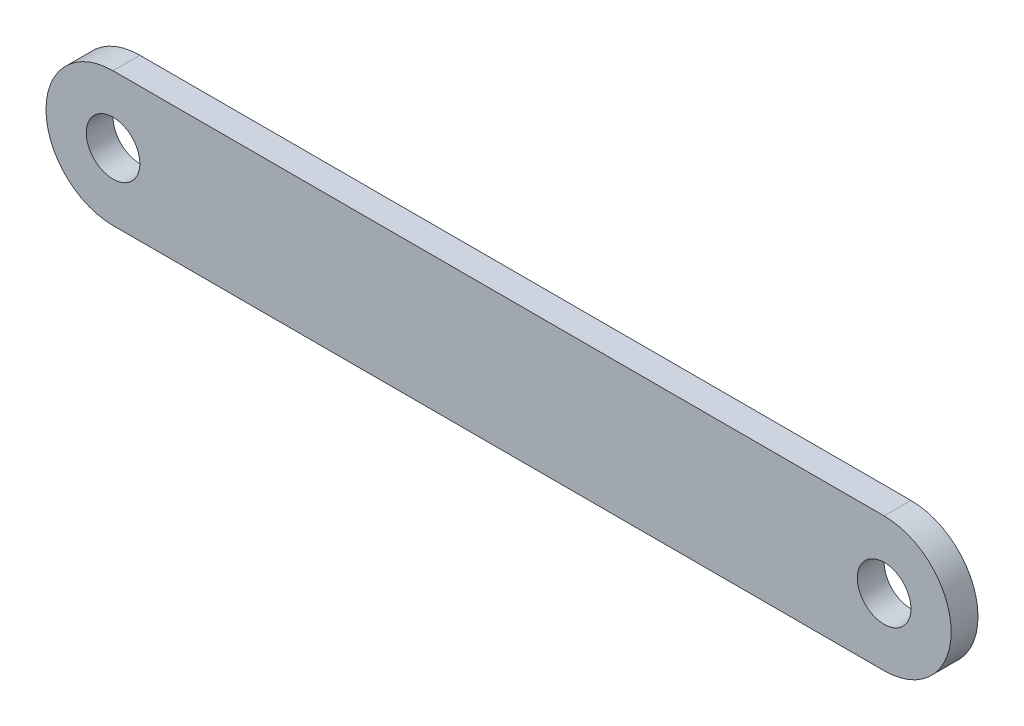
from build123d import *

# Parameters (mm, degrees)
SKETCH1_R           = 2
BOSS_EXTRUDE1_DEPTH = 2


with BuildPart() as part:
    # Sketch1 → Boss-Extrude1 (new body)
    with BuildSketch(Plane.XY):
        with BuildLine():
            Line((0, 5), (57.5, 5))
            ThreePointArc((57.5, 5), (62.5, 0), (57.5, -5))
            Line((57.5, -5), (0, -5))
            ThreePointArc((0, -5), (-5, 0), (0, 5))
        make_face()
        Circle(SKETCH1_R, mode=Mode.SUBTRACT)
        with Locations((57.5, 0)):
            Circle(SKETCH1_R, mode=Mode.SUBTRACT)
    extrude(amount=BOSS_EXTRUDE1_DEPTH)


solid = part.part
